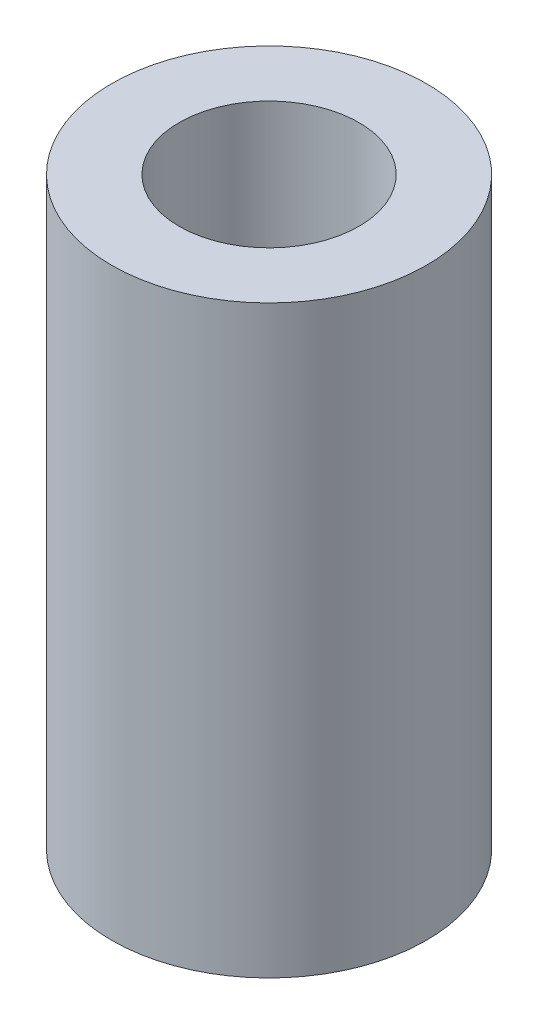
from build123d import *

# Parameters (mm, degrees)
ESQUISSE1_R             = 35
ESQUISSE1_R_2           = 20
BOSS_EXTRU_1_DEPTH      = 130
ENL_V_START             = -25
ESQUISSE2_R             = 8.75
ENL_V_MAT_EXTRU_1_DEPTH = 100
ESQUISSE3_R             = 7.5
ENL_V_MAT_EXTRU_2_DEPTH = 10


with BuildPart() as part:
    # Esquisse1 → Boss.-Extru.1 (new body)
    with BuildSketch(Plane(origin=(0, 0, 0), x_dir=(1, 0, 0), z_dir=(0, 1, 0))):
        with Locations(Location((0, 0, 0), (0, 0, 270))):
            Circle(ESQUISSE1_R)
        with Locations(Location((0, 0, 0), (0, 0, 270))):
            Circle(ESQUISSE1_R_2, mode=Mode.SUBTRACT)
    extrude(amount=BOSS_EXTRU_1_DEPTH)

    # Esquisse2 → Enlèv. mat.-Extru.1 (cut)
    with BuildSketch(Plane.XY.offset(ENL_V_START)):
        with Locations((0, 90)):
            Circle(ESQUISSE2_R)
        with Locations((0, 40)):
            Circle(ESQUISSE2_R)
    extrude(amount=-ENL_V_MAT_EXTRU_1_DEPTH, mode=Mode.SUBTRACT)

    # Esquisse3 → Enlèv. mat.-Extru.2 (cut)
    with BuildSketch(Plane(origin=(-35, 0, 0), x_dir=(0, 0, -1), z_dir=(1, 0, 0))):
        with Locations(Location((0, 100, 0), (0, 0, 180))):
            Circle(ESQUISSE3_R)
        with Locations(Location((0, 30, 0), (0, 0, 180))):
            Circle(ESQUISSE3_R)
    extrude(amount=ENL_V_MAT_EXTRU_2_DEPTH, mode=Mode.SUBTRACT)


solid = part.part
